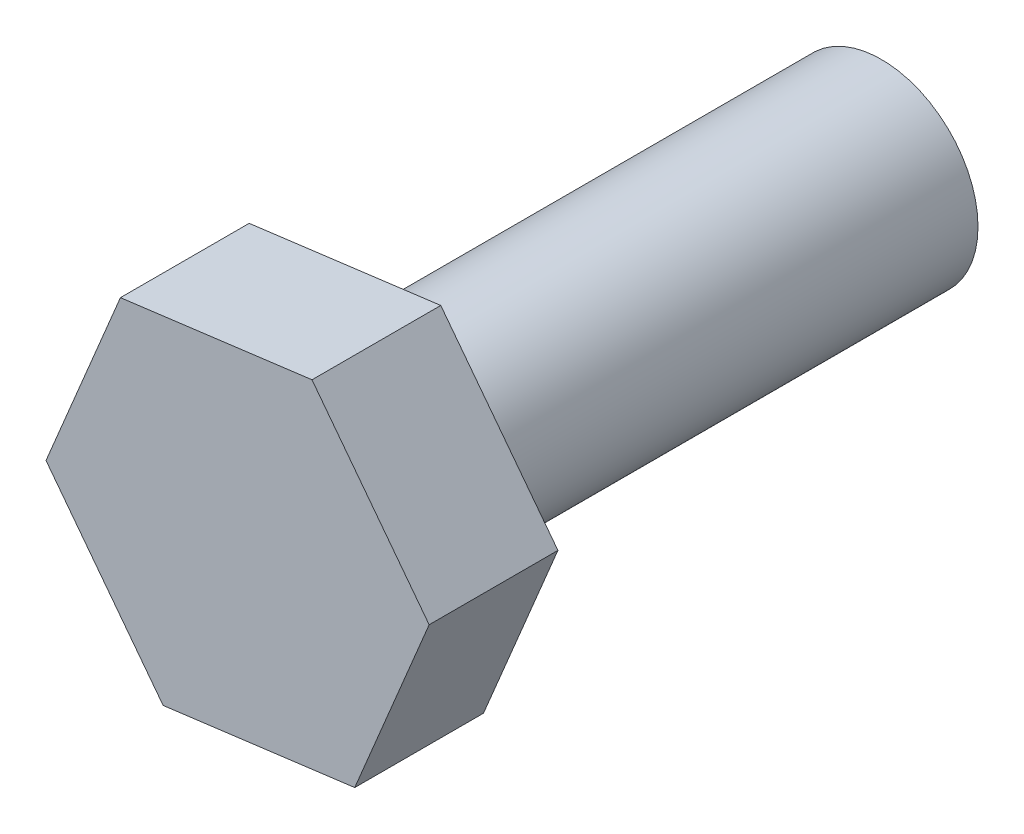
from build123d import *

# Parameters (mm, degrees)
SKETCH1_R      = 2.38125
EXTRUDE1_DEPTH = 12.7
EXTRUDE2_DEPTH = 3.175


with BuildPart() as part:
    # Sketch1 → Extrude1 (new body)
    with BuildSketch(Plane.XY):
        Circle(SKETCH1_R)
    extrude(amount=-EXTRUDE1_DEPTH)

    # Sketch2 → Extrude2 (add)
    with BuildSketch(Plane.XY):
        Polygon((1.835088085, 4.39475346), (-2.888424097, 3.786609629), (-4.723512182, -0.60814383), (-1.835088085, -4.39475346), (2.888424097, -3.786609629), (4.723512182, 0.60814383), align=None)
    extrude(amount=EXTRUDE2_DEPTH)


solid = part.part
